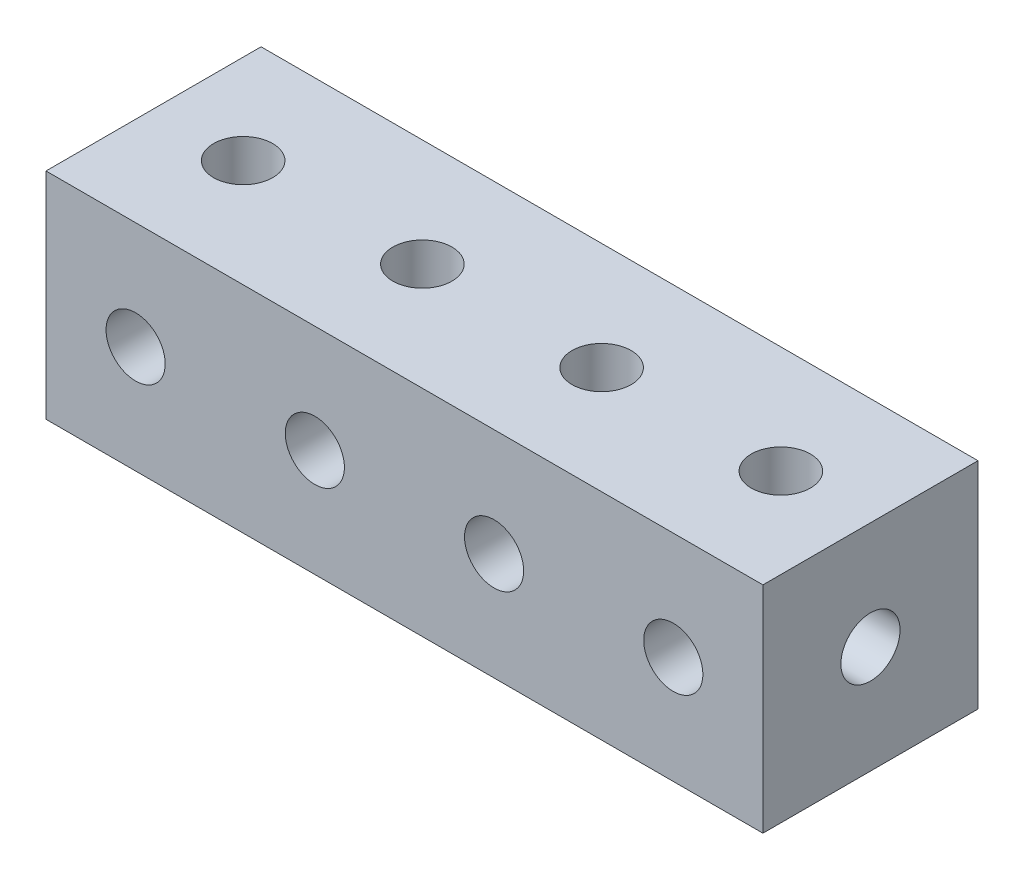
from build123d import *

# Parameters (mm, degrees)
ESQUISSE1_W             = 12
ESQUISSE1_H             = 12
BOSS_EXTRU_1_DEPTH      = 40
ESQUISSE2_R             = 1.65
ENL_V_MAT_EXTRU_1_DEPTH = 44.451121965
ESQUISSE3_R             = 1.65
ENL_V_MAT_EXTRU_2_DEPTH = 40
ESQUISSE4_R             = 1.65
ENL_V_MAT_EXTRU_3_DEPTH = 40


with BuildPart() as part:
    # Esquisse1 → Boss.-Extru.1 (new body)
    with BuildSketch(Plane(origin=(0, 0, 0), x_dir=(0, 0, -1), z_dir=(1, 0, 0))):
        with Locations((6, 6)):
            Rectangle(ESQUISSE1_W, ESQUISSE1_H)
    extrude(amount=BOSS_EXTRU_1_DEPTH)

    # Esquisse2 → Enlèv. mat.-Extru.1 (cut, through all)
    with BuildSketch(Plane(origin=(0, 12, 0), x_dir=(1, 0, 0), z_dir=(0, 1, 0))):
        with Locations(Location((5, 6, 0), (0, 0, 270))):
            Circle(ESQUISSE2_R)
        with Locations(Location((15, 6, 0), (0, 0, 270))):
            Circle(ESQUISSE2_R)
        with Locations(Location((25, 6, 0), (0, 0, 270))):
            Circle(ESQUISSE2_R)
        with Locations(Location((35, 6, 0), (0, 0, 270))):
            Circle(ESQUISSE2_R)
    extrude(amount=-ENL_V_MAT_EXTRU_1_DEPTH, mode=Mode.SUBTRACT)

    # Esquisse3 → Enlèv. mat.-Extru.2 (cut)
    with BuildSketch(Plane.XY):
        with Locations((5, 6)):
            Circle(ESQUISSE3_R)
        with Locations((15, 6)):
            Circle(ESQUISSE3_R)
        with Locations((25, 6)):
            Circle(ESQUISSE3_R)
        with Locations((35, 6)):
            Circle(ESQUISSE3_R)
    extrude(amount=-ENL_V_MAT_EXTRU_2_DEPTH, mode=Mode.SUBTRACT)

    # Esquisse4 → Enlèv. mat.-Extru.3 (cut)
    with BuildSketch(Plane(origin=(40, 0, 0), x_dir=(0, 0, -1), z_dir=(1, 0, 0))):
        with Locations(Location((6, 6, 0), (0, 0, 45))):
            Circle(ESQUISSE4_R)
    extrude(amount=-ENL_V_MAT_EXTRU_3_DEPTH, mode=Mode.SUBTRACT)


solid = part.part
